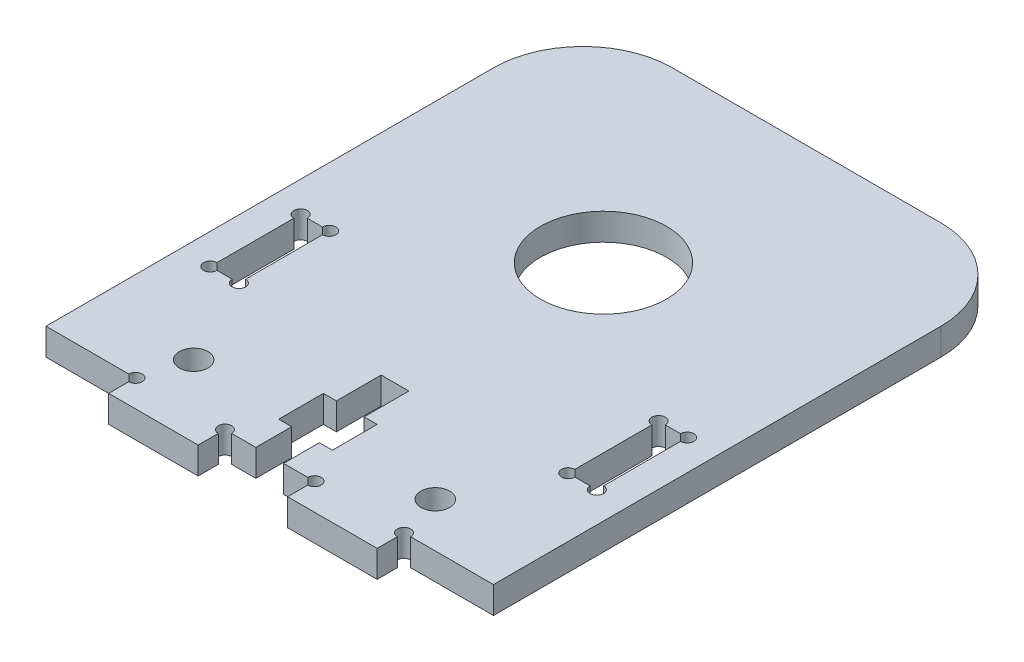
from build123d import *

# Parameters (mm, degrees)
SKETCH_1_W          = 50
SKETCH_1_H          = 60
EXTRUDE_1_DEPTH     = 3
SKETCH_2_W          = 10
SKETCH_2_H          = 3
EXTRUDE_2_DEPTH     = 3
CUT_EXTRUDE_1_DEPTH = 42.509035161
SKETCH_4_R          = 7.05
CUT_EXTRUDE_2_DEPTH = 42.509035161
SKETCH_5_R          = 1.6
SKETCH_5_W          = 3.2
SKETCH_5_H          = 10.1
CUT_EXTRUDE_3_DEPTH = 42.509035161
SKETCH_7_R          = 0.75
CUT_EXTRUDE_4_DEPTH = 42.509035161
FILLET_1_R          = 10


with BuildPart() as part:
    # 草图1 → 凸台-拉伸1 (new body)
    with BuildSketch(Plane(origin=(0, 0, 0), x_dir=(1, 0, 0), z_dir=(0, 1, 0))):
        Rectangle(SKETCH_1_W, SKETCH_1_H)
    extrude(amount=EXTRUDE_1_DEPTH)

    # 草图2 → 凸台-拉伸2 (add)
    with BuildSketch(Plane(origin=(0, 3, 0), x_dir=(1, 0, 0), z_dir=(0, 1, 0))):
        with Locations((-10, -31.5)):
            Rectangle(SKETCH_2_W, SKETCH_2_H)
        with Locations((10, -31.5)):
            Rectangle(SKETCH_2_W, SKETCH_2_H)
    extrude(amount=-EXTRUDE_2_DEPTH)

    # 草图3 → 切除-拉伸1 (cut, through all)
    with BuildSketch(Plane(origin=(0, 3, 0), x_dir=(1, 0, 0), z_dir=(0, 1, 0))):
        Polygon((-1.55, -30), (-1.55, -26), (-3, -26), (-3, -21), (-1.55, -21), (-1.55, -16), (1.55, -16), (1.55, -21), (3, -21), (3, -26), (1.55, -26), (1.55, -30), align=None)
    extrude(amount=-CUT_EXTRUDE_1_DEPTH, mode=Mode.SUBTRACT)

    # 草图4 → 切除-拉伸2 (cut, through all)
    with BuildSketch(Plane(origin=(0, 3, 0), x_dir=(1, 0, 0), z_dir=(0, 1, 0))):
        with Locations(Location((0, 7.290233074, 0), (0, 0, 270))):
            Circle(SKETCH_4_R)
    extrude(amount=-CUT_EXTRUDE_2_DEPTH, mode=Mode.SUBTRACT)

    # 草图5 → 切除-拉伸3 (cut, through all)
    with BuildSketch(Plane.XZ):
        with Locations(Location((13.5, 25, 0), (0, 0, 270))):
            Circle(SKETCH_5_R)
        with Locations(Location((-13.5, 25, 0), (0, 0, 90))):
            Circle(SKETCH_5_R)
        with Locations((20, 10)):
            Rectangle(SKETCH_5_W, SKETCH_5_H)
        with Locations((-20, 10)):
            Rectangle(SKETCH_5_W, SKETCH_5_H)
    extrude(amount=-CUT_EXTRUDE_3_DEPTH, mode=Mode.SUBTRACT)

    # 草图7 → 切除-拉伸4 (cut, through all)
    with BuildSketch(Plane.XZ):
        with Locations((-21.6, 15.05)):
            Circle(SKETCH_7_R)
        with Locations((-18.4, 15.05)):
            Circle(SKETCH_7_R)
        with Locations((-18.4, 4.95)):
            Circle(SKETCH_7_R)
        with Locations((-21.6, 4.95)):
            Circle(SKETCH_7_R)
        with Locations((21.6, 4.95)):
            Circle(SKETCH_7_R)
        with Locations((18.4, 4.95)):
            Circle(SKETCH_7_R)
        with Locations((18.4, 15.05)):
            Circle(SKETCH_7_R)
        with Locations((21.6, 15.05)):
            Circle(SKETCH_7_R)
        with Locations((-15, 30)):
            Circle(SKETCH_7_R)
        with Locations((-5, 30)):
            Circle(SKETCH_7_R)
        with Locations((5, 30)):
            Circle(SKETCH_7_R)
        with Locations((15, 30)):
            Circle(SKETCH_7_R)
    extrude(amount=-CUT_EXTRUDE_4_DEPTH, mode=Mode.SUBTRACT)

    # 圆角1
    fillet_1_edges = [part.edges().sort_by_distance(p)[0] for p in [
        (-25, 1.5, -30),
        (25, 1.5, -30),
    ]]
    fillet(fillet_1_edges, radius=FILLET_1_R)


solid = part.part
